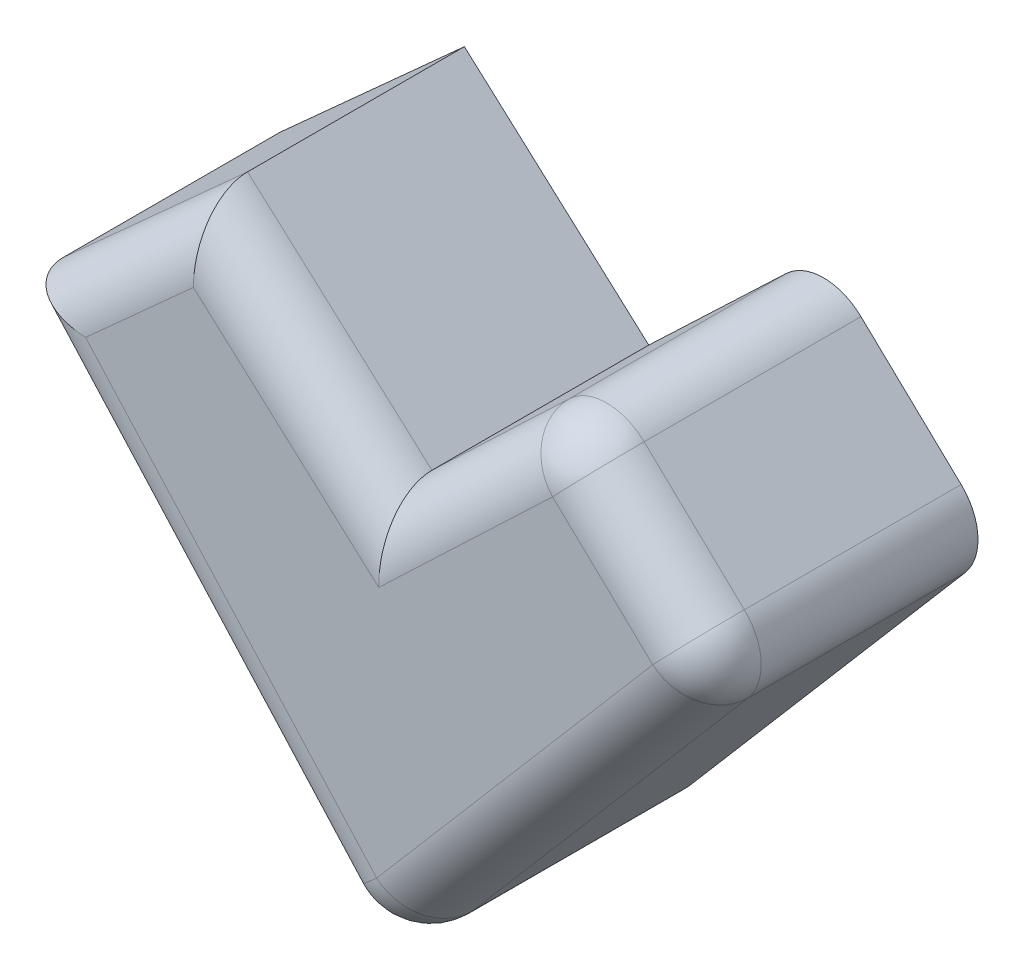
from build123d import *

# Parameters (mm, degrees)
BOSS_EXTRUDE1_DEPTH = 50
FILLET1_R           = 10


with BuildPart() as part:
    # Sketch1 → Boss-Extrude1 (new body)
    with BuildSketch(Plane.XY):
        Polygon((0, 0), (-68.020648891, 75.4139), (-34.010324446, 106.09), (0, 75.4139), (32.252675554, 106.09), (64.505351109, 75.4139), align=None)
    extrude(amount=BOSS_EXTRUDE1_DEPTH)

    # Fillet1
    fillet1_edges = [part.edges().sort_by_distance(p)[0] for p in [
        (0, 0, 25),
        (32.252675554, 106.09, 25),
        (64.505351109, 75.4139, 25),
        (16.126337777, 90.75195, 50),
        (-17.005162223, 90.75195, 50),
        (-51.015486668, 90.75195, 50),
        (-34.010324446, 37.70695, 50),
        (32.252675554, 37.70695, 50),
        (48.379013332, 90.75195, 50),
    ]]
    fillet(fillet1_edges, radius=FILLET1_R)


solid = part.part
